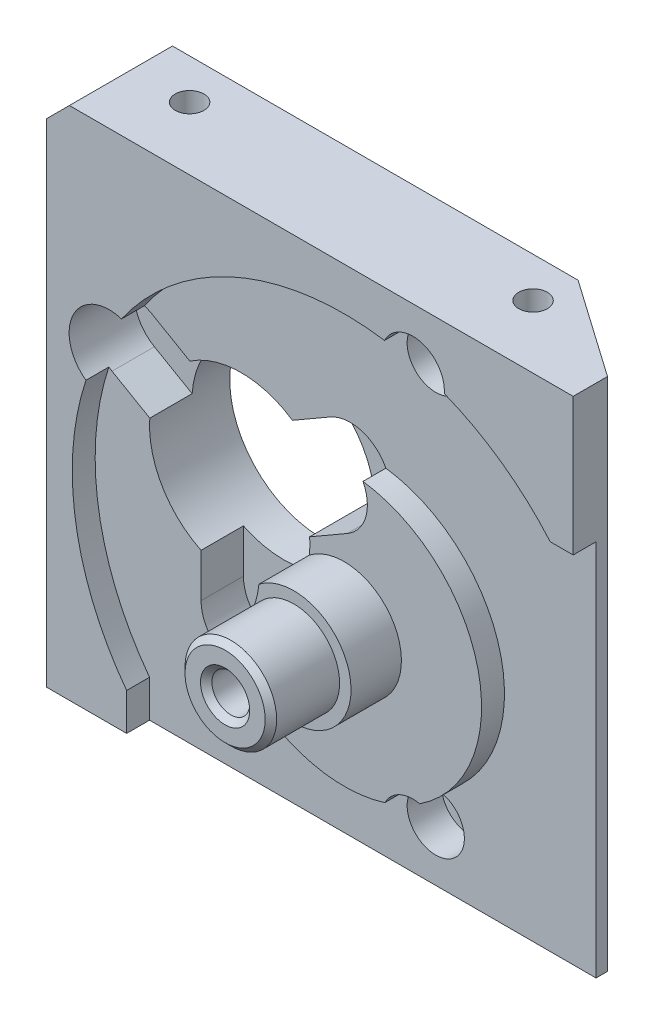
from build123d import *

# Parameters (mm, degrees)
SKETCH_1_W                  = 52
SKETCH_1_H                  = 47
EXTRUDE_1_DEPTH             = 9
SKETCH_19_R                 = 23.75
SKETCH_19_R_2               = 12
CUT_EXTRUDE_2_DEPTH         = 2
SKETCH_20_R                 = 5
EXTRUDE_3_DEPTH             = 4.4
SKETCH_21_R                 = 4
EXTRUDE_4_DEPTH             = 6
SKETCH_22_R                 = 8
CUT_EXTRUDE_5_DEPTH         = 37.556941885
CUT_EXTRUDE_6_DEPTH         = 47
HOLE_WIZARD_M3_1_D          = 2.5
HOLE_WIZARD_M3_1_DEPTH      = 9.5
HOLE_WIZARD_M3_1_TIP        = 0.751075774
HOLE_WIZARD_M4_2_D          = 3.3
HOLE_WIZARD_M4_2_DEPTH      = 10.1
HOLE_WIZARD_M4_2_TIP        = 0.991420021
CHAMFER_3_SIZE              = 0.5
CHAMFER_5_SIZE              = 2
EXTRUDE3_DEPTH              = 2
EXTRUDE4_REACH              = 57.474
CUT_EXTRUDE_START           = -31
SKETCH_34_R                 = 8
CUT_EXTRUDE_1_DEPTH         = 31
SKETCH_35_R                 = 3.25
CUT_EXTRUDE_2_2_DEPTH       = 33
PATTERN_CIRCULAR_1_COUNT    = 3
HOLE_WIZARD_2_AT_2_COUNT    = 2
HOLE_WIZARD_2_AT_2_PITCH    = 19.052558883
HOLE_WIZARD_2_AT_3_COUNT    = 2
HOLE_WIZARD_2_AT_3_PITCH    = 19.052558883
HOLE_WIZARD_M3_2_D          = 2.5
HOLE_WIZARD_M3_2_DEPTH      = 9.5
HOLE_WIZARD_M3_2_TIP        = 0.751075774
SKETCH_39_R                 = 2
CUT_EXTRUDE_3_DEPTH         = 2
SKETCH_40_R                 = 2.75
CUT_EXTRUDE_4_DEPTH         = 2
SKETCH_41_R                 = 1.1
CUT_EXTRUDE_5_2_DEPTH       = 37
CHAMFER_7_SIZE              = 0.5
HOLE_WIZARD_2_2_D           = 2
HOLE_WIZARD_2_2_CBORE_D     = 5
HOLE_WIZARD_2_2_CBORE_DEPTH = 3
CUT_EXTRUDE_START_2         = 7
CUT_EXTRUDE_7_DEPTH         = 7
PATTERN_CIRCULAR_2_COUNT    = 3
SKETCH_45_W                 = 2.943459277
SKETCH_45_H                 = 3.25
SKETCH_45_W_2               = 2.005209087
SKETCH_45_H_2               = 2.691311543
SKETCH_45_W_3               = 3.943459277
SKETCH_45_H_3               = 4.763787499
CUT_EXTRUDE_8_DEPTH         = 2


with BuildPart() as part:
    # 草图1 → 拉伸1 (new body)
    with BuildSketch(Plane.XY):
        Rectangle(SKETCH_1_W, SKETCH_1_H)
    extrude(amount=EXTRUDE_1_DEPTH)

    # 草图19 → Cut-Extrude 2 (cut)
    with BuildSketch(Plane.XY.offset(9)):
        with Locations((0, -4)):
            Circle(SKETCH_19_R)
        with Locations((0, -4)):
            Circle(SKETCH_19_R_2, mode=Mode.SUBTRACT)
    extrude(amount=-CUT_EXTRUDE_2_DEPTH, mode=Mode.SUBTRACT)

    # 草图20 → 拉伸3 (add)
    with BuildSketch(Plane.XY.offset(9)):
        with Locations((0, -4)):
            Circle(SKETCH_20_R)
    extrude(amount=EXTRUDE_3_DEPTH)

    # 草图21 → 拉伸4 (add)
    with BuildSketch(Plane.XY.offset(13.4)):
        with Locations((0, -4)):
            Circle(SKETCH_21_R)
    extrude(amount=EXTRUDE_4_DEPTH)

    # 草图22 → Cut-Extrude 5 (cut, through all)
    with BuildSketch(Plane.XY.offset(9)):
        with Locations((-11, 0.795831523)):
            Circle(SKETCH_22_R)
    extrude(amount=-CUT_EXTRUDE_5_DEPTH, mode=Mode.SUBTRACT)

    # 草图25 → 拉伸6 (cut)
    with BuildSketch(Plane.XZ.offset(23.5)):
        Polygon((26, 8), (14.574815946, 0), (26, 0), align=None)
    extrude(amount=-CUT_EXTRUDE_6_DEPTH, mode=Mode.SUBTRACT)

    # M3 螺纹孔1
    with Locations(Plane(origin=(11, 23.5, 3.5), x_dir=(0, 0, 1), z_dir=(0, 1, 0))):
        with Locations((0, 0), (0, -30)):
            Hole(HOLE_WIZARD_M3_1_D / 2, depth=HOLE_WIZARD_M3_1_DEPTH)
            with Locations((0, 0, -(HOLE_WIZARD_M3_1_DEPTH + HOLE_WIZARD_M3_1_TIP / 2))):  # 118° drill point
                Cone(0, HOLE_WIZARD_M3_1_D / 2, HOLE_WIZARD_M3_1_TIP, mode=Mode.SUBTRACT)

    # M4 螺纹孔2
    with Locations(Plane(origin=(0, -4, 19.4), x_dir=(1, 0, 0), z_dir=(0, 0, 1))):
        with Locations((0, 0)):
            Hole(HOLE_WIZARD_M4_2_D / 2, depth=HOLE_WIZARD_M4_2_DEPTH)
            with Locations((0, 0, -(HOLE_WIZARD_M4_2_DEPTH + HOLE_WIZARD_M4_2_TIP / 2))):  # 118° drill point
                Cone(0, HOLE_WIZARD_M4_2_D / 2, HOLE_WIZARD_M4_2_TIP, mode=Mode.SUBTRACT)

    # 倒角3
    chamfer_3_edges = [part.edges().sort_by_distance(p)[0] for p in [
        (-4, -4, 19.4),
        (1.65, -4, 19.4),
    ]]
    chamfer(chamfer_3_edges, length=CHAMFER_3_SIZE)

    # 倒角5
    chamfer_5_edges = [part.edges().sort_by_distance(p)[0] for p in [
        (-26, 23.5, 4.5),
    ]]
    chamfer(chamfer_5_edges, length=CHAMFER_5_SIZE)

    # Sketch4 → Extrude3 (cut)
    with BuildSketch(Plane.XZ.offset(23.5)):
        Polygon((-26, 0), (14.574815946, 0), (26, 8), (26, 9), (13.557746863, 9), (13.557746863, 7), (-13.557746863, 7), (-13.557746863, 9), (-26, 9), align=None)
    extrude(amount=-EXTRUDE3_DEPTH, mode=Mode.SUBTRACT)

    # Extrude4: up to this face of the body (flat: up to its plane)
    extrude4_end = Plane(part.part.faces().sort_by_distance((-1.330613504, 23.5, 4.737278788))[0])
    # Sketch5 → Extrude4 (cut, up to the picked face)
    with BuildSketch(Plane.XZ.offset(21.5), mode=Mode.PRIVATE) as extrude4_sk1:
        Polygon((26, 9), (20, 9), (20, 6), (11.43111196, 0), (14.574815946, 0), (26, 8), align=None)
    extrude4_tool1 = split(extrude(extrude4_sk1.sketch, amount=-EXTRUDE4_REACH, mode=Mode.PRIVATE), bisect_by=extrude4_end, keep=Keep.BOTH, mode=Mode.PRIVATE)
    add(extrude4_tool1.solids().sort_by(Axis((19.659359, -21.5, 5.073959), (0, 1, 0)))[0], mode=Mode.SUBTRACT)

    # 草图34 → 切除-拉伸1 (cut)
    with BuildSketch(Plane(origin=(0, 0, 0), x_dir=(-1, 0, 0), z_dir=(0, 0, -1)).offset(CUT_EXTRUDE_START)):
        with Locations(Location((11, 0.795831523, 0), (0, 0, 180))):
            Circle(SKETCH_34_R)
    extrude(amount=CUT_EXTRUDE_1_DEPTH, mode=Mode.SUBTRACT)

    # 草图35 → Cut-Extrude 2 2 (cut)
    with BuildSketch(Plane.XY.offset(7)):
        with Locations((-1.473720558, 6.295831523)):
            Circle(SKETCH_35_R)
    cut_extrude_2_2 = extrude(amount=CUT_EXTRUDE_2_2_DEPTH, mode=Mode.SUBTRACT)

    # 阵列(圆周)1: Cut-Extrude 2 2 ×3 about axis
    pattern_circular_1_axis = Axis((-11, 0.795831523, 0), (0, 0, 1))
    for i in range(1, PATTERN_CIRCULAR_1_COUNT):
        add(cut_extrude_2_2.rotate(pattern_circular_1_axis, i * 360 / PATTERN_CIRCULAR_1_COUNT), mode=Mode.SUBTRACT)

    # 草图36 → Hole Wizard 2 (revolve, cut)
    with BuildSketch(Plane(origin=(-20.526279442, 6.295831523, 7), x_dir=(0, -1, 0), z_dir=(1, 0, 0))):
        Polygon((0, 0), (0, 7), (1.5, 7), (1.5, 3.7), (3.5, 3.7), (3.5, 0), align=None)
    hole_wizard_2 = revolve(axis=Axis((-20.526279442, 6.295831523, 13.35), (0, 0, -1)), mode=Mode.SUBTRACT)

    # Hole Wizard 2 at 2: Hole Wizard 2 ×2
    with Locations(*[(i * HOLE_WIZARD_2_AT_2_PITCH, 0, 0) for i in range(1, HOLE_WIZARD_2_AT_2_COUNT)]):
        add(hole_wizard_2, mode=Mode.SUBTRACT)

    # Hole Wizard 2 at 3: Hole Wizard 2 ×2
    with Locations(*[Vector(0.49999999999999795, -0.8660254037844398, 0) * (i * HOLE_WIZARD_2_AT_3_PITCH) for i in range(1, HOLE_WIZARD_2_AT_3_COUNT)]):
        add(hole_wizard_2, mode=Mode.SUBTRACT)

    # M3 螺纹孔2
    with Locations(Plane(origin=(-24, -21.5, 3.5), x_dir=(0, 0, -1), z_dir=(0, -1, 0))):
        with Locations((0, 0), (0, 35)):
            Hole(HOLE_WIZARD_M3_2_D / 2, depth=HOLE_WIZARD_M3_2_DEPTH)
            with Locations((0, 0, -(HOLE_WIZARD_M3_2_DEPTH + HOLE_WIZARD_M3_2_TIP / 2))):  # 118° drill point
                Cone(0, HOLE_WIZARD_M3_2_D / 2, HOLE_WIZARD_M3_2_TIP, mode=Mode.SUBTRACT)

    # 草图39 → 切除-拉伸3 (cut)
    with BuildSketch(Plane(origin=(0, 0, 0), x_dir=(-1, 0, 0), z_dir=(0, 0, -1))):
        with Locations((-6, 18.295831523)):
            Circle(SKETCH_39_R)
        with Locations((-6, -16.704168477)):
            Circle(SKETCH_39_R)
    extrude(amount=-CUT_EXTRUDE_3_DEPTH, mode=Mode.SUBTRACT)

    # 草图40 → 切除-拉伸4 (cut)
    with BuildSketch(Plane.XY.offset(9)):
        with Locations((6, 18.295831523)):
            Circle(SKETCH_40_R)
        with Locations((6, -16.704168477)):
            Circle(SKETCH_40_R)
    extrude(amount=-CUT_EXTRUDE_4_DEPTH, mode=Mode.SUBTRACT)

    # 草图41 → Cut-Extrude 5 2 (cut)
    with BuildSketch(Plane(origin=(0, 0, 2), x_dir=(-1, 0, 0), z_dir=(0, 0, -1))):
        with Locations((-6, 18.295831523)):
            Circle(SKETCH_41_R)
        with Locations((-6, -16.704168477)):
            Circle(SKETCH_41_R)
    extrude(amount=-CUT_EXTRUDE_5_2_DEPTH, mode=Mode.SUBTRACT)

    # 倒角7
    chamfer_7_edges = [part.edges().sort_by_distance(p)[0] for p in [
        (8, 18.295831523, 0),
        (8, -16.704168477, 0),
    ]]
    chamfer(chamfer_7_edges, length=CHAMFER_7_SIZE)

    # Hole Wizard 2 2 (through all)
    with Locations(Plane(origin=(6, 18.295831523, 7), x_dir=(1, 0, 0), z_dir=(0, 0, 1))):
        with Locations((0, 0), (0, -35)):
            CounterBoreHole(HOLE_WIZARD_2_2_D / 2, HOLE_WIZARD_2_2_CBORE_D / 2, HOLE_WIZARD_2_2_CBORE_DEPTH)

    # 草图44 → 切除-拉伸7 (cut)
    with BuildSketch(Plane.XY.offset(3.3).offset(CUT_EXTRUDE_START_2)):
        with BuildLine():
            Line((0.276279442, 3.26474261), (-9.25, -2.23525739))
            ThreePointArc((-9.25, -2.23525739), (-14.031088913, -0.954168477), (-12.75, 3.826920437))
            Line((-12.75, 3.826920437), (-3.223720558, 9.326920437))
            ThreePointArc((-3.223720558, 9.326920437), (1.557368355, 8.045831523), (0.276279442, 3.26474261))
        make_face()
    cut_extrude_7 = extrude(amount=-CUT_EXTRUDE_7_DEPTH, mode=Mode.SUBTRACT)

    # 阵列(圆周)2: 切除-拉伸7 ×3 about axis
    pattern_circular_2_axis = Axis((-11, 0.795831523, 0), (0, 0, 1))
    for i in range(1, PATTERN_CIRCULAR_2_COUNT):
        add(cut_extrude_7.rotate(pattern_circular_2_axis, i * 360 / PATTERN_CIRCULAR_2_COUNT), mode=Mode.SUBTRACT)

    # 草图45 → 切除-拉伸8 (cut)
    with BuildSketch(Plane.XY.offset(9)):
        with Locations((-17.528270361, -19.875)):
            Rectangle(SKETCH_45_W, SKETCH_45_H)
        with Locations((18.997395457, 10.154344229)):
            Rectangle(SKETCH_45_W_2, SKETCH_45_H_2)
        with Locations((18.028270361, -19.11810625)):
            Rectangle(SKETCH_45_W_3, SKETCH_45_H_3)
    extrude(amount=-CUT_EXTRUDE_8_DEPTH, mode=Mode.SUBTRACT)


solid = part.part
